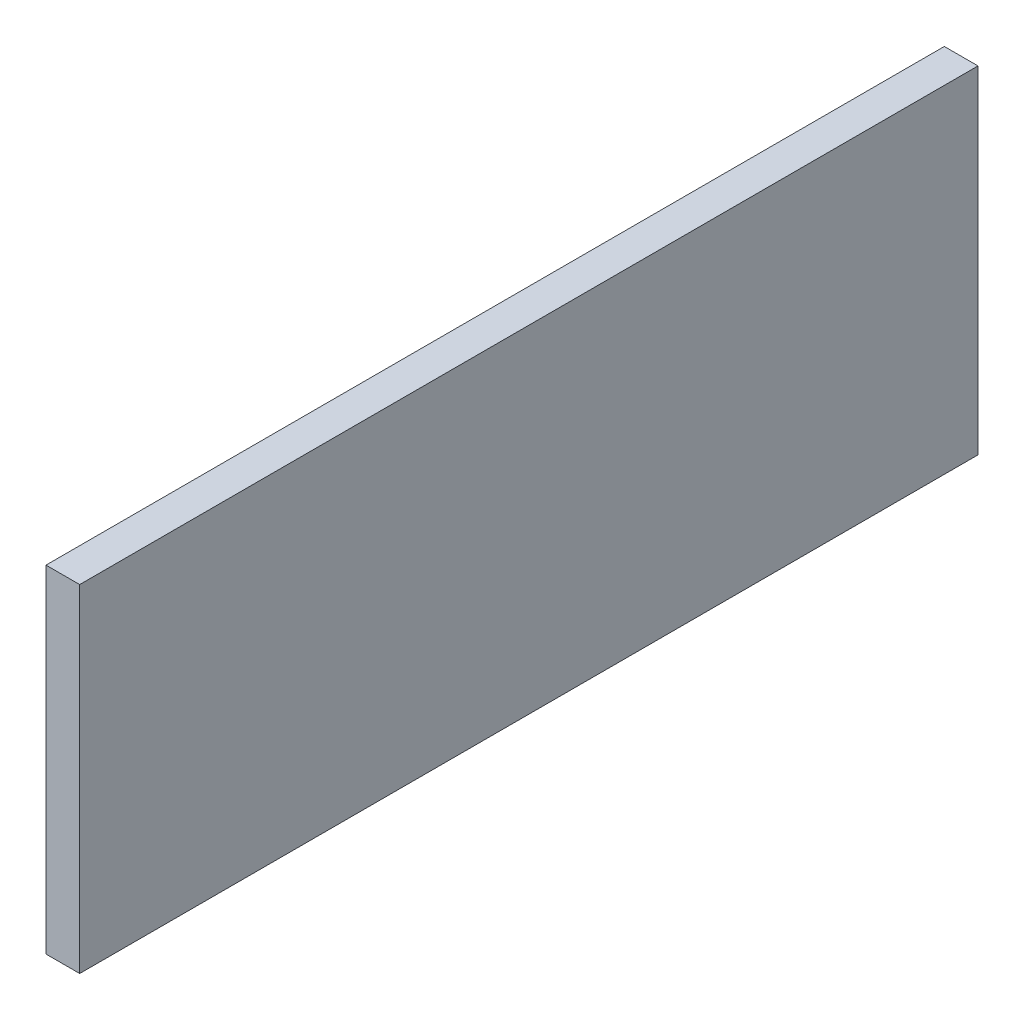
from build123d import *

# Parameters (mm, degrees)
SKETCH1_W           = 80
SKETCH1_H           = 30
BOSS_EXTRUDE1_DEPTH = 3


with BuildPart() as part:
    # Sketch1 → Boss-Extrude1 (new body)
    with BuildSketch(Plane(origin=(0, 0, 0), x_dir=(0, 0, -1), z_dir=(1, 0, 0))):
        with Locations((5.801526718, 18.879952224)):
            Rectangle(SKETCH1_W, SKETCH1_H)
    extrude(amount=BOSS_EXTRUDE1_DEPTH)


solid = part.part
